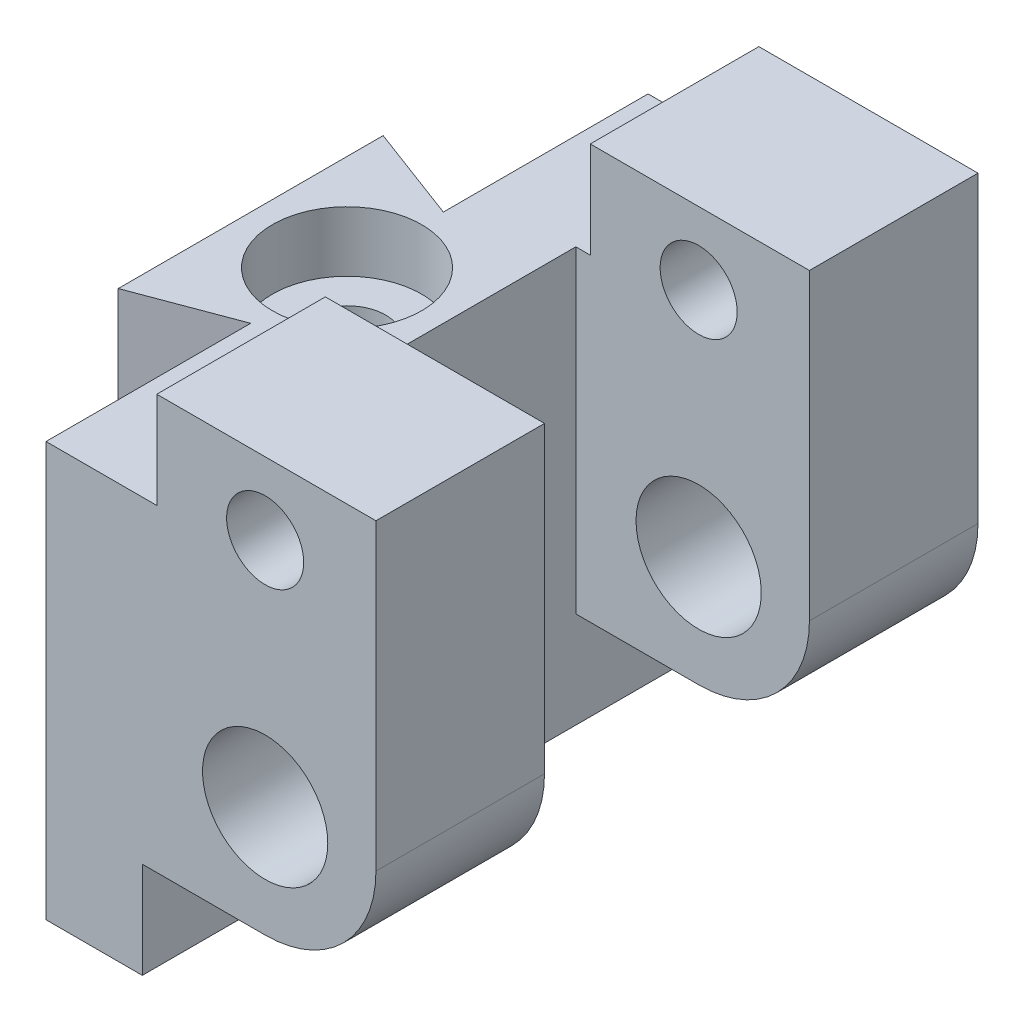
from build123d import *

# Parameters (mm, degrees)
CROQUIS1_R                 = 2.6
SALIENTE_EXTRUIR1_DEPTH    = 25
CROQUIS2_W                 = 9.7
CROQUIS2_H                 = 11
CORTAR_EXTRUIR1_DEPTH      = 25
CROQUIS3_W                 = 4
CROQUIS3_H                 = 8
SALIENTE_EXTRUIR2_DEPTH    = 17.2
CORTAR_EXTRUIR2_DEPTH      = 1.25
CORTAR_EXTRUIR2_DEPTH_BACK = 1.25
CROQUIS5_R                 = 1.6
CORTAR_EXTRUIR3_DEPTH      = 34.25
SALIENTE_EXTRUIR3_DEPTH    = 17.2
SALIENTE_EXTRUIR4_REACH    = 31.505
CORTAR_EXTRUIR4_DEPTH      = 27.25
CORTAR_EXTRUIR4_DEPTH_BACK = 27.25
CROQUIS13_W                = 9.7
CROQUIS13_H                = 11
CROQUIS15_R                = 1.6
CORTAR_EXTRUIR6_DEPTH      = 27.25
CROQUIS16_W                = 0.6
CROQUIS16_H                = 3
CORTAR_EXTRUIR7_DEPTH      = 33
CROQUIS17_R                = 3.1
CORTAR_EXTRUIR8_DEPTH      = 2.5
CROQUIS18_W                = 9.1
CROQUIS18_H                = 7
SALIENTE_EXTRUIR5_DEPTH    = 1


with BuildPart() as part:
    # Croquis1 → Saliente-Extruir1 (new body)
    with BuildSketch(Plane.XY):
        with BuildLine():
            Line((-9.1, 8.6), (-5.1, 8.6))
            Line((-5.1, 8.6), (-5.1, 4.6))
            Line((-5.1, 4.6), (0, 4.6))
            ThreePointArc((0, 4.6), (4.6, 0), (0, -4.6))
            Line((0, -4.6), (-5.1, -4.6))
            Line((-5.1, -4.6), (-5.1, -8.6))
            Line((-5.1, -8.6), (-9.1, -8.6))
            Line((-9.1, -8.6), (-9.1, 8.6))
        make_face()
        Circle(CROQUIS1_R, mode=Mode.SUBTRACT)
    extrude(amount=SALIENTE_EXTRUIR1_DEPTH)

    # Croquis2 → Cortar-Extruir1 (cut)
    with BuildSketch(Plane(origin=(0, 4.6, 0), x_dir=(1, 0, 0), z_dir=(0, 1, 0))):
        with Locations((-0.25, -12.5)):
            Rectangle(CROQUIS2_W, CROQUIS2_H)
    extrude(amount=-CORTAR_EXTRUIR1_DEPTH, mode=Mode.SUBTRACT)

    # Croquis3 → Saliente-Extruir2 (add)
    with BuildSketch(Plane(origin=(0, 8.6, 0), x_dir=(1, 0, 0), z_dir=(0, 1, 0))):
        with Locations((-11.1, -12.5)):
            Rectangle(CROQUIS3_W, CROQUIS3_H)
    extrude(amount=-SALIENTE_EXTRUIR2_DEPTH)

    # Croquis4 → Cortar-Extruir2 (cut, two sides: drawn at the far end of the back side and taken through both)
    with BuildSketch(Plane(origin=(0, -0.6, 0), x_dir=(-1, 0, 0), z_dir=(0, -1, 0)).offset(-CORTAR_EXTRUIR2_DEPTH_BACK)):
        Polygon((7.01228676, -9.75), (5.1, -9.75), (5.1, -15.25), (7.01228676, -15.25), (10.68771324, -15.25), (12.275426481, -12.5), (10.68771324, -9.75), align=None)
    extrude(amount=CORTAR_EXTRUIR2_DEPTH + CORTAR_EXTRUIR2_DEPTH_BACK, mode=Mode.SUBTRACT)

    # Croquis5 → Cortar-Extruir3 (cut)
    with BuildSketch(Plane.XZ.offset(8.6)):
        with Locations(Location((-9.1, 12.5, 0), (0, 0, 270))):
            Circle(CROQUIS5_R)
    extrude(amount=-CORTAR_EXTRUIR3_DEPTH, mode=Mode.SUBTRACT)

    # Croquis6 → Saliente-Extruir3 (add)
    with BuildSketch(Plane.XZ.offset(8.6)):
        Polygon((-13.1, 18), (-9.1, 16.5), (-13.1, 16.5), align=None)
        Polygon((-13.1, 8.5), (-13.1, 7), (-9.1, 8.5), align=None)
    extrude(amount=-SALIENTE_EXTRUIR3_DEPTH)

    # Saliente-Extruir4: up to this face of the body (flat: up to its plane)
    saliente_extruir4_end = Plane(part.part.faces().sort_by_distance((-4.253300765, 0, 0))[0])
    # Croquis12 → Saliente-Extruir4 (add, up to the picked face)
    with BuildSketch(Plane.XY.offset(25), mode=Mode.PRIVATE) as saliente_extruir4_sk1:
        with BuildLine():
            Line((1.9, 11.6), (4.6, 11.6))
            Line((4.6, 11.6), (4.6, 0))
            Line((4.6, 0), (4, 0))
            ThreePointArc((4, 0), (2.828427125, 2.828427125), (0, 4))
            Line((0, 4), (0, 4.6))
            Line((0, 4.6), (-5.1, 4.6))
            Line((-5.1, 4.6), (-5.1, 11.6))
            Line((-5.1, 11.6), (1.9, 11.6))
        make_face()
    saliente_extruir4_tool1 = split(extrude(saliente_extruir4_sk1.sketch, amount=-SALIENTE_EXTRUIR4_REACH, mode=Mode.PRIVATE), bisect_by=saliente_extruir4_end, keep=Keep.BOTH, mode=Mode.PRIVATE)
    add(saliente_extruir4_tool1.solids().sort_by(Axis((0.135432, 7.547356, 25), (0, 0, -1)))[0])

    # Croquis13 → Cortar-Extruir4 (cut, two sides: drawn at the far end of the back side and taken through both)
    with BuildSketch(Plane.XZ.offset(-4.6).offset(-CORTAR_EXTRUIR4_DEPTH_BACK)):
        with Locations((-0.25, 12.5)):
            Rectangle(CROQUIS13_W, CROQUIS13_H)
    extrude(amount=CORTAR_EXTRUIR4_DEPTH + CORTAR_EXTRUIR4_DEPTH_BACK, mode=Mode.SUBTRACT)

    # Croquis15 → Cortar-Extruir6 (cut)
    with BuildSketch(Plane.XY.offset(25)):
        with Locations((0, 9.6)):
            Circle(CROQUIS15_R)
    extrude(amount=-CORTAR_EXTRUIR6_DEPTH, mode=Mode.SUBTRACT)

    # Croquis16 → Cortar-Extruir7 (cut)
    with BuildSketch(Plane.XY.offset(25)):
        with Locations((-4.8, 10.1)):
            Rectangle(CROQUIS16_W, CROQUIS16_H)
    extrude(amount=-CORTAR_EXTRUIR7_DEPTH, mode=Mode.SUBTRACT)

    # Croquis17 → Cortar-Extruir8 (cut)
    with BuildSketch(Plane(origin=(0, 8.6, 0), x_dir=(1, 0, 0), z_dir=(0, 1, 0))):
        with Locations(Location((-9.1, -12.5, 0), (0, 0, 270))):
            Circle(CROQUIS17_R)
    extrude(amount=-CORTAR_EXTRUIR8_DEPTH, mode=Mode.SUBTRACT)

    # Croquis18 → Saliente-Extruir5 (add)
    with BuildSketch(Plane(origin=(0, 11.6, 0), x_dir=(1, 0, 0), z_dir=(0, 1, 0))):
        with Locations((0.05, -21.5)):
            Rectangle(CROQUIS18_W, CROQUIS18_H)
        with Locations((0.05, -3.5)):
            Rectangle(CROQUIS18_W, CROQUIS18_H)
    extrude(amount=SALIENTE_EXTRUIR5_DEPTH)


solid = part.part
